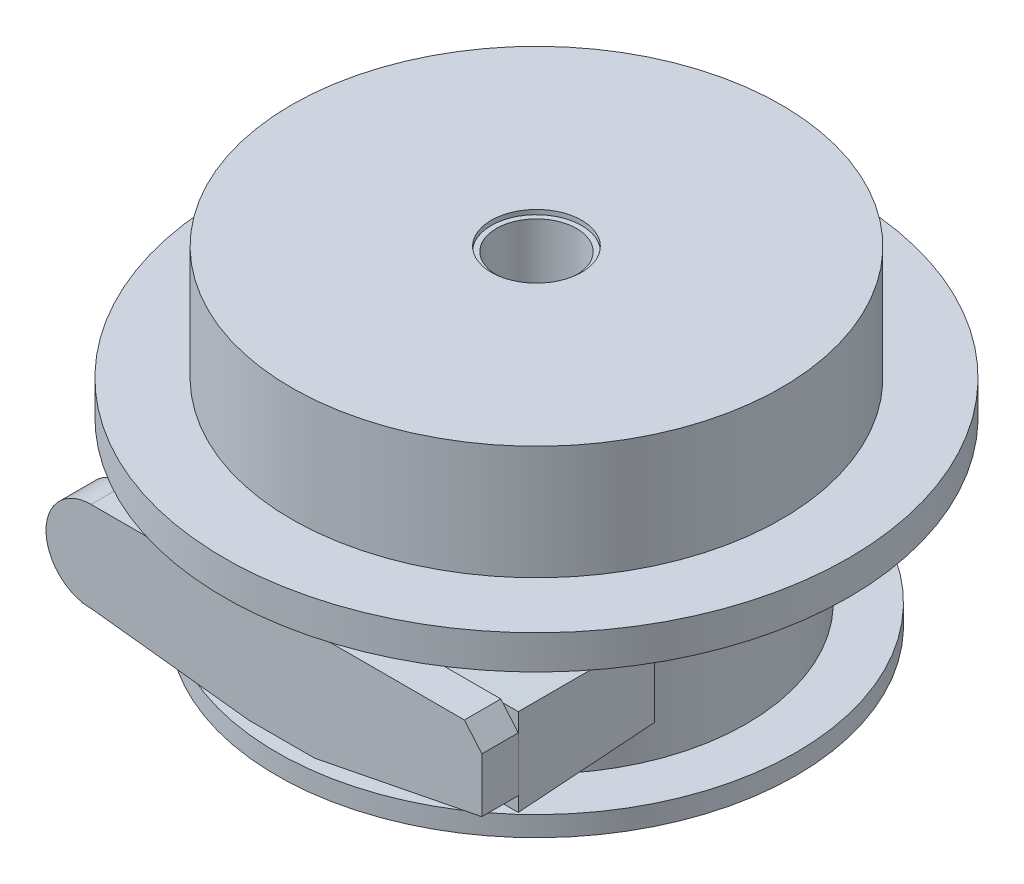
from build123d import *

# Parameters (mm, degrees)
BOSS_EXTRUDE1_REACH      = 97.167
BOSS_EXTRUDE1_END_RADIUS = 28.847569448
SKETCH2_W                = 55
SKETCH2_H                = 12
BOSS_EXTRUDE1_DRAFT      = -2
BOSS_EXTRUDE2_DEPTH      = 5


with BuildPart() as part:
    # Sketch1 → Revolve1 (revolve)
    with BuildSketch(Plane.XY, mode=Mode.PRIVATE) as revolve1_sk:
        Polygon((5.51, 42.955132593), (5.51, -10.526859692), (6.21, -10.526859692), (6.21, -11.156859692), (8.117657505, -11.156859692), (10.386196058, -5.377232125), (28.847569448, -5.377232125), (28.847569448, -1.58033765), (35.664678952, -1.58033765), (35.664678952, 1.169396269), (28.847569448, 1.169396269), (28.847569448, 18.677058662), (33.66, 21.427260592), (42.91, 23.261015516), (42.91, 27.935132593), (33.66, 27.935132593), (33.66, 43.585132593), (6.21, 43.585132593), (6.21, 42.955132593), align=None)
    revolve(revolve1_sk.sketch.rotate(Axis((0, 28.345538502, 0), (0, -1, 0)), 180), axis=Axis((0, 28.345538502, 0), (0, -1, 0)))

    # Boss-Extrude1: up to this cylinder (the profile starts outside it)
    boss_extrude1_end = Plane(origin=(0, 10.956247, 0), z_dir=(0, 1, 0)) * Cylinder(BOSS_EXTRUDE1_END_RADIUS, 253.029138896, mode=Mode.PRIVATE)



with BuildPart() as boss_extrude1_long_prism_1:
    # Sketch2 → Boss-Extrude1 (the long prism of profile 1, to be tilted and cut off)
    with BuildSketch(Plane.XY.offset(30)):
        with Locations((0, 10.956246724)):
            Rectangle(SKETCH2_W, SKETCH2_H)
    extrude(amount=-BOSS_EXTRUDE1_REACH)
    boss_extrude1_tool1_sides = [boss_extrude1_long_prism_1.faces().sort_by_distance(p)[0] for p in [
        (0, 16.956246724, -18.5835),
        (-27.5, 10.956246724, -18.5835),
        (0, 4.956246724, -18.5835),
        (27.5, 10.956246724, -18.5835),
    ]]
    draft(boss_extrude1_tool1_sides, Plane.XY.offset(30), BOSS_EXTRUDE1_DRAFT)  # the draft: side faces tilted about the start plane


with BuildPart() as part_1:
    add(part.part)
    boss_extrude1_tool1 = boss_extrude1_long_prism_1.part - boss_extrude1_end
    add(boss_extrude1_tool1.solids().sort_by_distance((0, 10.956247, 30))[0])

    # Sketch3 → Boss-Extrude2 (add)
    with BuildSketch(Plane.XY.offset(30)):
        with BuildLine():
            ThreePointArc((-27.18192553, 4.956246724), (-26.694955, 4.898123787), (-26.204912516, 4.878708906))
            Line((-26.204912516, 4.878708906), (-4.504702211, 2.425132726))
            Line((-4.504702211, 2.425132726), (4.504702211, 2.425132726))
            Line((4.504702211, 2.425132726), (27.5, 6.956827348))
            Line((27.5, 6.956827348), (27.5, 14.431115524))
            Line((27.5, 14.431115524), (25.099356835, 17.26707076))
            Line((25.099356835, 17.26707076), (-26.204912516, 17.26707076))
            ThreePointArc((-26.204912516, 17.26707076), (-32.364772816, 11.724041467), (-27.5, 5.01561109))
            Line((-27.5, 5.01561109), (-27.5, 4.956246724))
            Line((-27.5, 4.956246724), (-27.18192553, 4.956246724))
        make_face()
    extrude(amount=BOSS_EXTRUDE2_DEPTH)


solid = part_1.part
